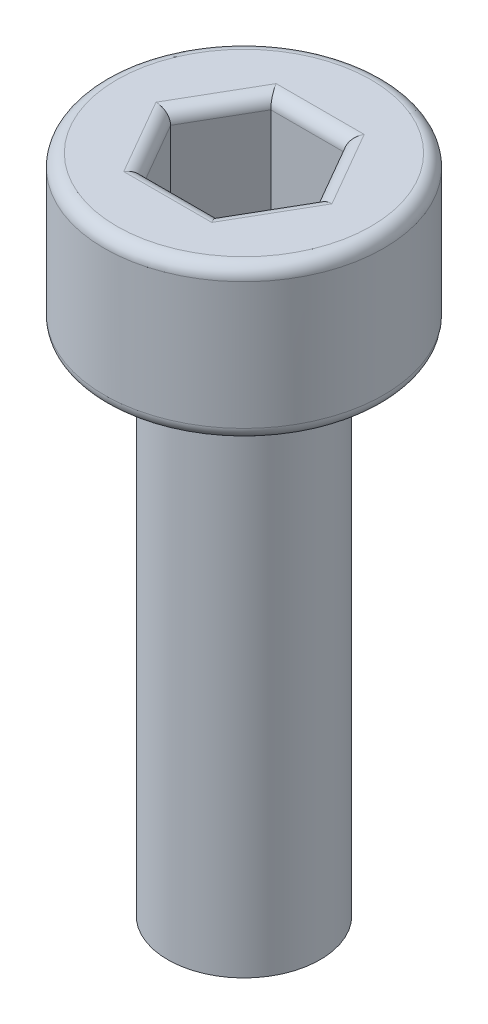
from build123d import *

# Parameters (mm, degrees)
CUT_EXTRUDE1_DEPTH = 2
FILLET1_R          = 0.25


with BuildPart() as part:
    # Sketch2 → Revolve1 (revolve)
    with BuildSketch(Plane.XY, mode=Mode.PRIVATE) as revolve1_sk:
        Polygon((0, 3), (2.75, 3), (2.75, 0), (1.5, 0), (1.5, -10), (0, -10), align=None)
    revolve(revolve1_sk.sketch.rotate(Axis((0, 21.322324325, 0), (0, -1, 0)), 180), axis=Axis((0, 21.322324325, 0), (0, -1, 0)))

    # Sketch3 → Cut-Extrude1 (cut)
    with BuildSketch(Plane(origin=(0, 3, 0), x_dir=(1, 0, 0), z_dir=(0, 1, 0))):
        Polygon((1.443375673, 0), (0.721687836, 1.25), (-0.721687836, 1.25), (-1.443375673, 0), (-0.721687836, -1.25), (0.721687836, -1.25), align=None)
    extrude(amount=-CUT_EXTRUDE1_DEPTH, mode=Mode.SUBTRACT)

    # Fillet1
    fillet1_edges = [part.edges().sort_by_distance(p)[0] for p in [
        (1.082531755, 3, 0.625),
        (1.082531755, 3, -0.625),
        (0, 3, -1.25),
        (-1.082531755, 3, -0.625),
        (-1.082531755, 3, 0.625),
        (0, 3, 1.25),
        (1.5, 0, 0),
        (2.75, 0, 0),
        (2.75, 3, 0),
    ]]
    fillet(fillet1_edges, radius=FILLET1_R)


solid = part.part
